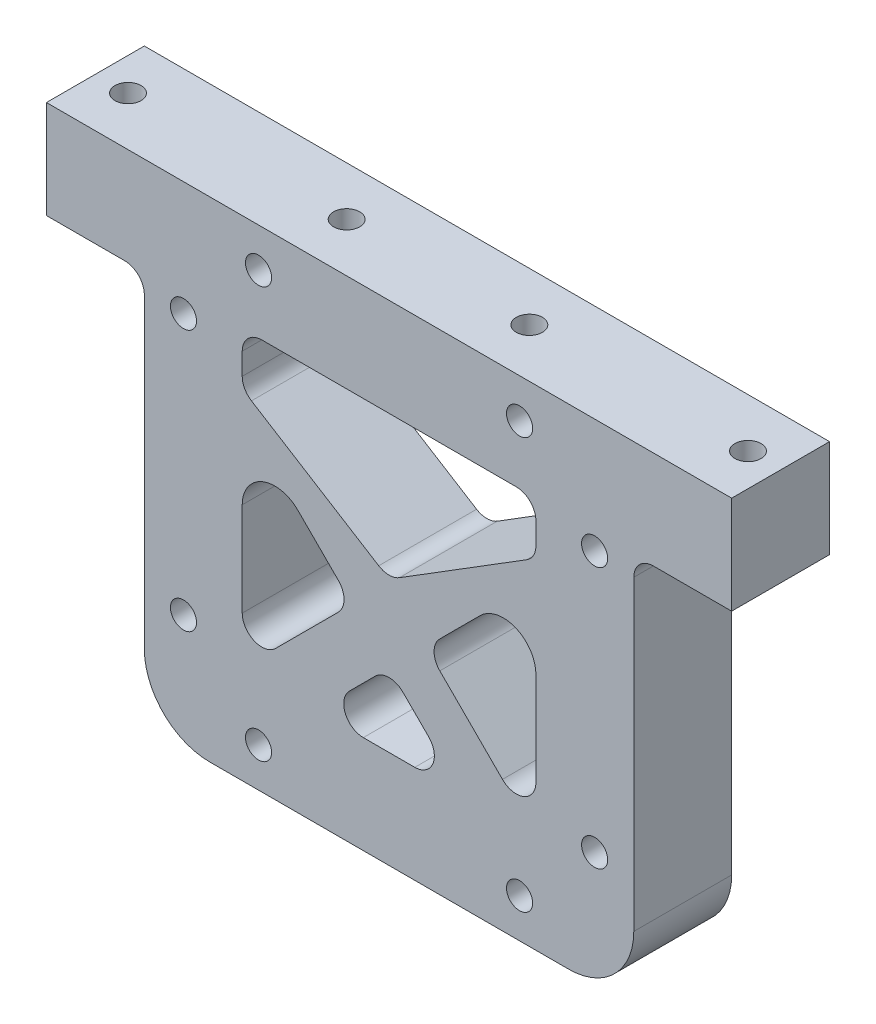
from build123d import *

# Parameters (mm, degrees)
SKETCH_1_W          = 75
SKETCH_1_H          = 75
EXTRUDE_1_DEPTH     = 15
SKETCH_2_R          = 2
CUT_EXTRUDE_1_DEPTH = 15
SKETCH_3_R          = 2
CUT_EXTRUDE_2_DEPTH = 56.113519213
FILLET_1_R          = 10
CUT_EXTRUDE_4_DEPTH = 15
CUT_EXTRUDE_5_DEPTH = 56.113519213
FILLET_3_R          = 5
FILLET_4_R          = 3
SKETCH_6_R          = 2
CUT_EXTRUDE_6_DEPTH = 15
SKETCH_8_W          = 15
SKETCH_8_H          = 15
EXTRUDE_2_DEPTH     = 15
FILLET_5_R          = 3
SKETCH_9_R          = 2
CUT_EXTRUDE_8_DEPTH = 93.769876576


with BuildPart() as part:
    # 草图1 → 凸台-拉伸1 (new body)
    with BuildSketch(Plane.XY):
        Rectangle(SKETCH_1_W, SKETCH_1_H)
    extrude(amount=EXTRUDE_1_DEPTH)

    # 草图2 → 切除-拉伸1 (cut)
    with BuildSketch(Plane.XY.offset(15)):
        with Locations((-20, 31.5)):
            Circle(SKETCH_2_R)
        with Locations((20, 31.5)):
            Circle(SKETCH_2_R)
        with Locations((20, -31.5)):
            Circle(SKETCH_2_R)
        with Locations((-20, -31.5)):
            Circle(SKETCH_2_R)
    extrude(amount=-CUT_EXTRUDE_1_DEPTH, mode=Mode.SUBTRACT)

    # 草图3 → 切除-拉伸2 (cut, through all)
    with BuildSketch(Plane.XY.offset(15)):
        with Locations((-31.5, 20)):
            Circle(SKETCH_3_R)
        with Locations((-31.5, -20)):
            Circle(SKETCH_3_R)
        with Locations((31.5, -20)):
            Circle(SKETCH_3_R)
        with Locations((31.5, 20)):
            Circle(SKETCH_3_R)
    extrude(amount=-CUT_EXTRUDE_2_DEPTH, mode=Mode.SUBTRACT)

    # 圆角1
    fillet_1_edges = [part.edges().sort_by_distance(p)[0] for p in [
        (37.5, -37.5, 7.5),
        (-37.5, -37.5, 7.5),
    ]]
    fillet(fillet_1_edges, radius=FILLET_1_R)

    # 草图4 → 切除-拉伸4 (cut)
    with BuildSketch(Plane.XY.offset(15)):
        Polygon((-5.656854249, -5.656854249), (-22.5, 11.186291501), (-22.5, -22.5), align=None)
        Polygon((0, -11.313708499), (-11.186291501, -22.5), (11.186291501, -22.5), align=None)
        Polygon((22.5, -22.5), (22.5, 11.186291501), (5.656854249, -5.656854249), align=None)
    extrude(amount=-CUT_EXTRUDE_4_DEPTH, mode=Mode.SUBTRACT)

    # 草图5 → 切除-拉伸5 (cut, through all)
    with BuildSketch(Plane.XY.offset(15)):
        Polygon((22.5, 22.5), (-22.5, 22.5), (-22.5, 14.5), (0, 0.5), (22.5, 14.5), align=None)
    extrude(amount=-CUT_EXTRUDE_5_DEPTH, mode=Mode.SUBTRACT)

    # 圆角3
    fillet_3_edges = [part.edges().sort_by_distance(p)[0] for p in [
        (22.5, 11.186291501, 7.5),
        (-22.5, 11.186291501, 7.5),
    ]]
    fillet(fillet_3_edges, radius=FILLET_3_R)

    # 圆角4
    fillet_4_edges = [part.edges().sort_by_distance(p)[0] for p in [
        (22.5, 14.5, 7.5),
        (0, 0.5, 7.5),
        (-22.5, 14.5, 7.5),
        (-22.5, 22.5, 7.5),
        (22.5, 22.5, 7.5),
        (-11.186291501, -22.5, 7.5),
        (0, -11.313708499, 7.5),
        (11.186291501, -22.5, 7.5),
        (5.656854249, -5.656854249, 7.5),
        (22.5, -22.5, 7.5),
        (-5.656854249, -5.656854249, 7.5),
        (-22.5, -22.5, 7.5),
    ]]
    fillet(fillet_4_edges, radius=FILLET_4_R)

    # 草图6 → 切除-拉伸6 (cut)
    with BuildSketch(Plane(origin=(0, 37.5, 0), x_dir=(1, 0, 0), z_dir=(0, 1, 0))):
        with Locations(Location((-14, -7.5, 0), (0, 0, 270))):
            Circle(SKETCH_6_R)
        with Locations(Location((14, -7.5, 0), (0, 0, 90))):
            Circle(SKETCH_6_R)
    extrude(amount=-CUT_EXTRUDE_6_DEPTH, mode=Mode.SUBTRACT)

    # 草图8 → 凸台-拉伸2 (add)
    with BuildSketch(Plane.XY.offset(15)):
        with Locations((-45, 30)):
            Rectangle(SKETCH_8_W, SKETCH_8_H)
        with Locations((45, 30)):
            Rectangle(SKETCH_8_W, SKETCH_8_H)
    extrude(amount=-EXTRUDE_2_DEPTH)

    # 圆角5
    fillet_5_edges = [part.edges().sort_by_distance(p)[0] for p in [
        (-37.5, 22.5, 7.5),
        (37.5, 22.5, 7.5),
    ]]
    fillet(fillet_5_edges, radius=FILLET_5_R)

    # 草图9 → 切除-拉伸8 (cut, through all)
    with BuildSketch(Plane(origin=(0, 37.5, 0), x_dir=(1, 0, 0), z_dir=(0, 1, 0))):
        with Locations(Location((-47.5, -7.5, 0), (0, 0, 270))):
            Circle(SKETCH_9_R)
        with Locations((47.5, -7.5)):
            Circle(SKETCH_9_R)
    extrude(amount=-CUT_EXTRUDE_8_DEPTH, mode=Mode.SUBTRACT)


solid = part.part
